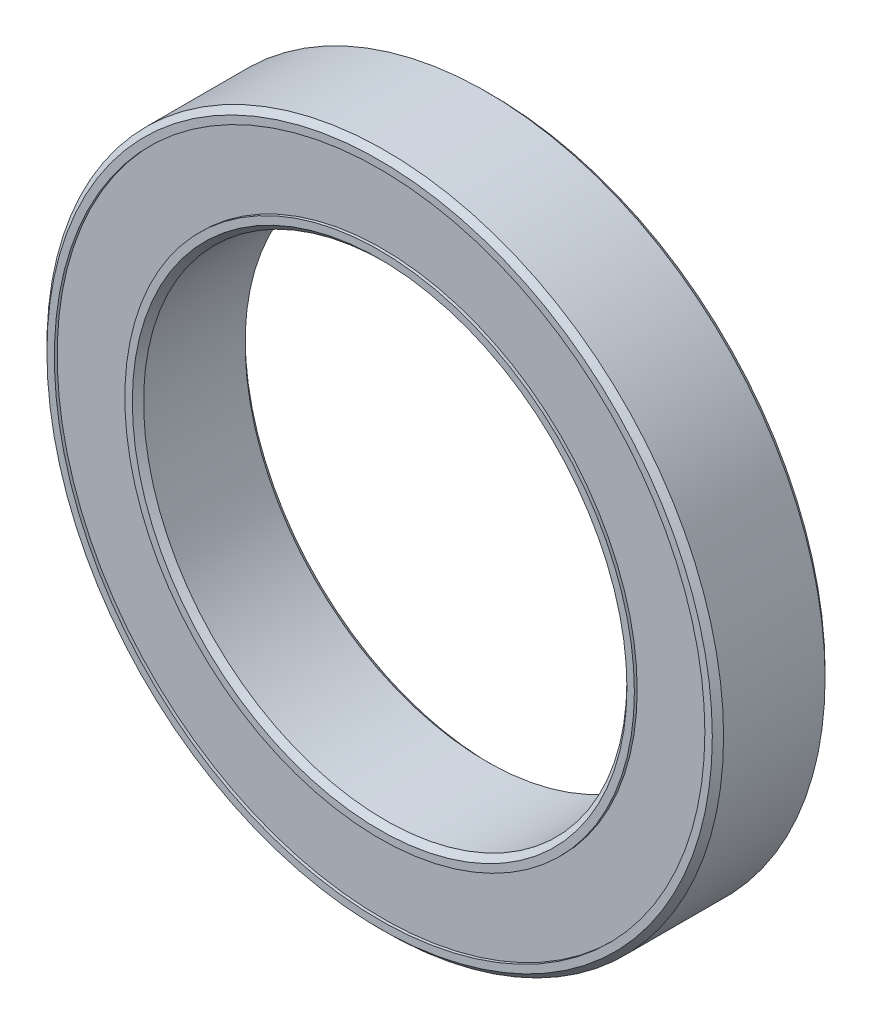
from build123d import *

# Parameters (mm, degrees)
CIRPATTERN1_COUNT = 12
SKETCH5_W         = 0.640803782
SKETCH5_H         = 4.375


with BuildPart() as part:
    # Sketch3 → Revolve1 (revolve)
    with BuildSketch(Plane(origin=(0, 0, 0), x_dir=(0, 0, -1), z_dir=(1, 0, 0)), mode=Mode.PRIVATE) as revolve1_sk:
        with BuildLine():
            Line((-3.5, 20.65), (-3.5, 20.18725))
            Line((-3.5, 20.18725), (-1.555555556, 20.18725))
            ThreePointArc((-1.555555556, 20.18725), (0, 20.683946218), (1.555555556, 20.18725))
            Line((1.555555556, 20.18725), (3.5, 20.18725))
            Line((3.5, 20.18725), (3.5, 20.65))
            Line((3.5, 20.65), (3.15, 21))
            Line((3.15, 21), (-3.15, 21))
            Line((-3.15, 21), (-3.5, 20.65))
        make_face()
        with BuildLine():
            Line((-3.5, 15.3495), (-3.5, 15.81225))
            Line((-3.5, 15.81225), (-1.555555556, 15.81225))
            ThreePointArc((-1.555555556, 15.81225), (0, 15.315553782), (1.555555556, 15.81225))
            Line((1.555555556, 15.81225), (3.5, 15.81225))
            Line((3.5, 15.81225), (3.5, 15.3495))
            Line((3.5, 15.3495), (3.15, 14.9995))
            Line((3.15, 14.9995), (-3.15, 14.9995))
            Line((-3.15, 14.9995), (-3.5, 15.3495))
        make_face()
    revolve(revolve1_sk.sketch.rotate(Axis((0, 0, 3.5), (0, 0, -1)), 90), axis=Axis((0, 0, 3.5), (0, 0, -1)))


with BuildPart() as body_2:
    # Sketch4 → Revolve2 (revolve)
    with BuildSketch(Plane(origin=(0, 0, 0), x_dir=(0, 0, -1), z_dir=(1, 0, 0))):
        with BuildLine():
            Line((-2.684196218, 17.99975), (2.684196218, 17.99975))
            ThreePointArc((2.684196218, 17.99975), (0, 20.683946218), (-2.684196218, 17.99975))
        make_face()
    revolve(axis=Axis((0, 17.99975, 2.684196218), (0, 0, -1)))


with BuildPart() as cirpattern1_1:
    # CirPattern1: pattern copy
    add(body_2.part.rotate(Axis((0, 0, 0), (0, 0, 1)), 1 * 360 / CIRPATTERN1_COUNT))


with BuildPart() as cirpattern1_2:
    # CirPattern1: pattern copy
    add(body_2.part.rotate(Axis((0, 0, 0), (0, 0, 1)), 2 * 360 / CIRPATTERN1_COUNT))


with BuildPart() as cirpattern1_3:
    # CirPattern1: pattern copy
    add(body_2.part.rotate(Axis((0, 0, 0), (0, 0, 1)), 3 * 360 / CIRPATTERN1_COUNT))


with BuildPart() as cirpattern1_4:
    # CirPattern1: pattern copy
    add(body_2.part.rotate(Axis((0, 0, 0), (0, 0, 1)), 4 * 360 / CIRPATTERN1_COUNT))


with BuildPart() as cirpattern1_5:
    # CirPattern1: pattern copy
    add(body_2.part.rotate(Axis((0, 0, 0), (0, 0, 1)), 5 * 360 / CIRPATTERN1_COUNT))


with BuildPart() as cirpattern1_6:
    # CirPattern1: pattern copy
    add(body_2.part.rotate(Axis((0, 0, 0), (0, 0, 1)), 6 * 360 / CIRPATTERN1_COUNT))


with BuildPart() as cirpattern1_7:
    # CirPattern1: pattern copy
    add(body_2.part.rotate(Axis((0, 0, 0), (0, 0, 1)), 7 * 360 / CIRPATTERN1_COUNT))


with BuildPart() as cirpattern1_8:
    # CirPattern1: pattern copy
    add(body_2.part.rotate(Axis((0, 0, 0), (0, 0, 1)), 8 * 360 / CIRPATTERN1_COUNT))


with BuildPart() as cirpattern1_9:
    # CirPattern1: pattern copy
    add(body_2.part.rotate(Axis((0, 0, 0), (0, 0, 1)), 9 * 360 / CIRPATTERN1_COUNT))


with BuildPart() as cirpattern1_10:
    # CirPattern1: pattern copy
    add(body_2.part.rotate(Axis((0, 0, 0), (0, 0, 1)), 10 * 360 / CIRPATTERN1_COUNT))


with BuildPart() as cirpattern1_11:
    # CirPattern1: pattern copy
    add(body_2.part.rotate(Axis((0, 0, 0), (0, 0, 1)), 11 * 360 / CIRPATTERN1_COUNT))


with BuildPart() as body_14:
    # Sketch5 → Revolve3 (revolve)
    with BuildSketch(Plane(origin=(0, 0, 0), x_dir=(0, 0, -1), z_dir=(1, 0, 0)), mode=Mode.PRIVATE) as revolve3_sk:
        with Locations((-3.004598109, 17.99975)):
            Rectangle(SKETCH5_W, SKETCH5_H)
        with Locations((3.004598109, 17.99975)):
            Rectangle(SKETCH5_W, SKETCH5_H)
    revolve(revolve3_sk.sketch.rotate(Axis((0, 0, 3.5), (0, 0, -1)), 90), axis=Axis((0, 0, 3.5), (0, 0, -1)))


solid = Compound([part.part, body_2.part, cirpattern1_1.part, cirpattern1_2.part, cirpattern1_3.part, cirpattern1_4.part, cirpattern1_5.part, cirpattern1_6.part, cirpattern1_7.part, cirpattern1_8.part, cirpattern1_9.part, cirpattern1_10.part, cirpattern1_11.part, body_14.part])
